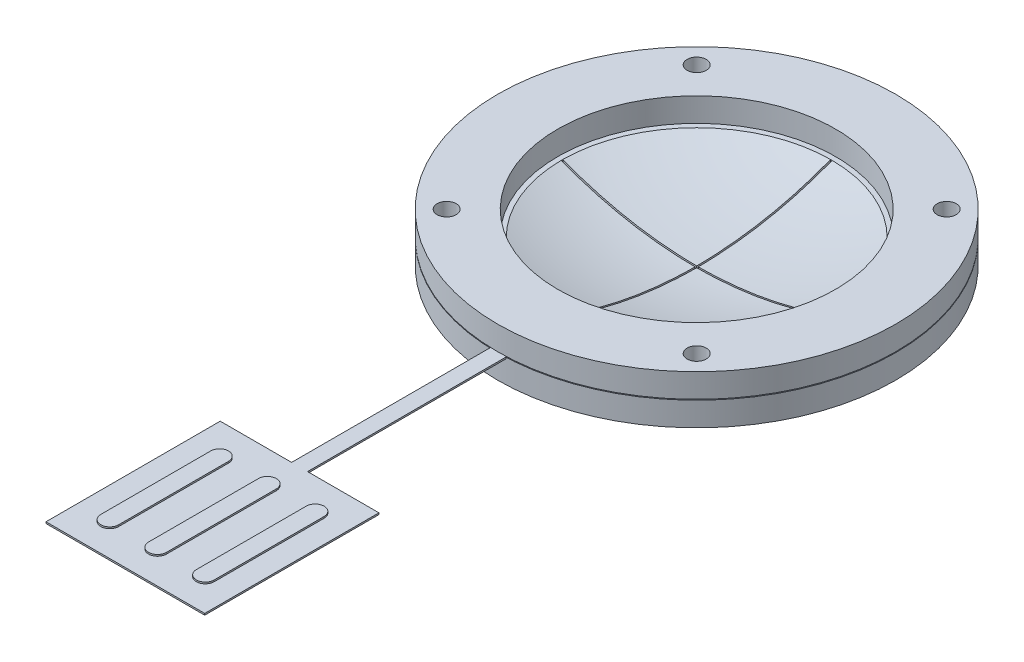
from build123d import *

# Parameters (mm, degrees)
KES_EKSTR_ZYON1_REACH       = 145.077
KES_EKSTR_ZYON1_END_RADIUS  = 240
Y_KSEKLIK_EKSTR_ZYON1_DEPTH = 1
Y_KSEKLIK_EKSTR_ZYON2_DEPTH = 1
IZIM5_R                     = 125
IZIM5_R_2                   = 87.230350479
IZIM5_R_3                   = 6
Y_KSEKLIK_EKSTR_ZYON4_DEPTH = 15
IZIM6_R                     = 125
IZIM6_R_2                   = 99.987437211
IZIM6_R_3                   = 6
Y_KSEKLIK_EKSTR_ZYON6_DEPTH = 15


with BuildPart() as part:
    # Çizim1 → Döndür1 (revolve)
    with BuildSketch(Plane(origin=(0, 0, 0), x_dir=(0, 0, -1), z_dir=(1, 0, 0))):
        with BuildLine():
            Line((-84.578292723, 0), (-99.987437211, 0))
            ThreePointArc((-99.987437211, 0), (-51.170303888, -16.301555778), (0, -21.82))
            Line((0, -21.82), (0, -15.82))
            ThreePointArc((0, -15.82), (-43.022552226, -11.830999737), (-84.578292723, 0))
        make_face()
    revolve(axis=Axis((0, 0, 0), (0, -1, 0)))

    # Kes-Ekstrüzyon1: up to this sphere (the profile starts inside it)
    kes_ekstr_zyon1_end = Location((0, 218.18, 0)) * Sphere(KES_EKSTR_ZYON1_END_RADIUS, mode=Mode.PRIVATE)
    # Çizim2 → Kes-Ekstrüzyon1 (cut, up to the surface)
    with BuildSketch(Plane(origin=(0, 0, 0), x_dir=(1, 0, 0), z_dir=(0, 1, 0)), mode=Mode.PRIVATE) as kes_ekstr_zyon1_sk1:
        Polygon((-0.5, -0.5), (-84.57681479, -0.5), (-84.57681479, 0.5), (-0.5, 0.5), (-0.5, 84.57681479), (0.5, 84.57681479), (0.5, 0.5), (86.521798987, 0.5), (86.521798987, -0.5), (0.5, -0.5), (0.5, -86.521798987), (-0.5, -86.521798987), align=None)
    kes_ekstr_zyon1_tool1 = extrude(kes_ekstr_zyon1_sk1.sketch, amount=-KES_EKSTR_ZYON1_REACH, mode=Mode.PRIVATE) & kes_ekstr_zyon1_end
    add(kes_ekstr_zyon1_tool1.solids().sort_by_distance((0.487671, 0, 0.487671))[0], mode=Mode.SUBTRACT)

    # Çizim3 → Yükseklik-Ekstrüzyon1 (add)
    with BuildSketch(Plane(origin=(0, 0, 0), x_dir=(1, 0, 0), z_dir=(0, 1, 0))):
        Polygon((-5, -249.333468386), (-49.82370334, -249.333468386), (-49.82370334, -358.714534318), (49.82370334, -358.714534318), (49.82370334, -249.333468386), (5, -249.333468386), (5, -95.85370377), (-5, -95.85370377), align=None)
    extrude(amount=-Y_KSEKLIK_EKSTR_ZYON1_DEPTH)

    # Çizim4 → Yükseklik-Ekstrüzyon2 (add)
    with BuildSketch(Plane(origin=(0, 0, 0), x_dir=(1, 0, 0), z_dir=(0, 1, 0))):
        with BuildLine():
            Line((35.61012652, -269.521723251), (35.61012652, -338.526279453))
            ThreePointArc((35.61012652, -338.526279453), (30, -344.136405973), (24.38987348, -338.526279453))
            Line((24.38987348, -338.526279453), (24.38987348, -269.521723251))
            ThreePointArc((24.38987348, -269.521723251), (30, -263.911596731), (35.61012652, -269.521723251))
        make_face()
        with BuildLine():
            Line((5.61012652, -269.521723251), (5.61012652, -338.526279453))
            ThreePointArc((5.61012652, -338.526279453), (0, -344.136405973), (-5.61012652, -338.526279453))
            Line((-5.61012652, -338.526279453), (-5.61012652, -269.521723251))
            ThreePointArc((-5.61012652, -269.521723251), (0, -263.911596731), (5.61012652, -269.521723251))
        make_face()
        with BuildLine():
            Line((-24.38987348, -269.521723251), (-24.38987348, -338.526279453))
            ThreePointArc((-24.38987348, -338.526279453), (-30, -344.136405973), (-35.61012652, -338.526279453))
            Line((-35.61012652, -338.526279453), (-35.61012652, -269.521723251))
            ThreePointArc((-35.61012652, -269.521723251), (-30, -263.911596731), (-24.38987348, -269.521723251))
        make_face()
    extrude(amount=Y_KSEKLIK_EKSTR_ZYON2_DEPTH)


with BuildPart() as body_2:
    # Çizim5 → Yükseklik-Ekstrüzyon4 (new body)
    with BuildSketch(Plane(origin=(0, 0, 0), x_dir=(1, 0, 0), z_dir=(0, 1, 0))):
        with Locations(Location((-0.5, 0.5, 0), (0, 0, 270))):
            Circle(IZIM5_R)
        with Locations(Location((-0.5, 0.5, 0), (0, 0, 270))):
            Circle(IZIM5_R_2, mode=Mode.SUBTRACT)
        with Locations(Location((-78.988852712, 78.988852712, 0), (0, 0, 270))):
            Circle(IZIM5_R_3, mode=Mode.SUBTRACT)
        with Locations(Location((77.988852712, 78.988852712, 0), (0, 0, 270))):
            Circle(IZIM5_R_3, mode=Mode.SUBTRACT)
        with Locations(Location((77.988852712, -77.988852712, 0), (0, 0, 270))):
            Circle(IZIM5_R_3, mode=Mode.SUBTRACT)
        with Locations(Location((-78.988852712, -77.988852712, 0), (0, 0, 270))):
            Circle(IZIM5_R_3, mode=Mode.SUBTRACT)
    extrude(amount=Y_KSEKLIK_EKSTR_ZYON4_DEPTH)


with BuildPart() as body_3:
    # Çizim6 → Yükseklik-Ekstrüzyon6 (new body)
    with BuildSketch(Plane.XZ):
        with Locations(Location((0, 0, 0), (0, 0, 270))):
            Circle(IZIM6_R)
        with Locations(Location((0, 0, 0), (0, 0, 270))):
            Circle(IZIM6_R_2, mode=Mode.SUBTRACT)
        with Locations(Location((77.988852712, -78.988852712, 0), (0, 0, 270))):
            Circle(IZIM6_R_3, mode=Mode.SUBTRACT)
        with Locations(Location((-78.988852712, -78.988852712, 0), (0, 0, 270))):
            Circle(IZIM6_R_3, mode=Mode.SUBTRACT)
        with Locations(Location((-78.988852712, 77.988852712, 0), (0, 0, 270))):
            Circle(IZIM6_R_3, mode=Mode.SUBTRACT)
        with Locations(Location((77.988852712, 77.988852712, 0), (0, 0, 270))):
            Circle(IZIM6_R_3, mode=Mode.SUBTRACT)
    extrude(amount=Y_KSEKLIK_EKSTR_ZYON6_DEPTH)


solid = Compound([part.part, body_2.part, body_3.part])
